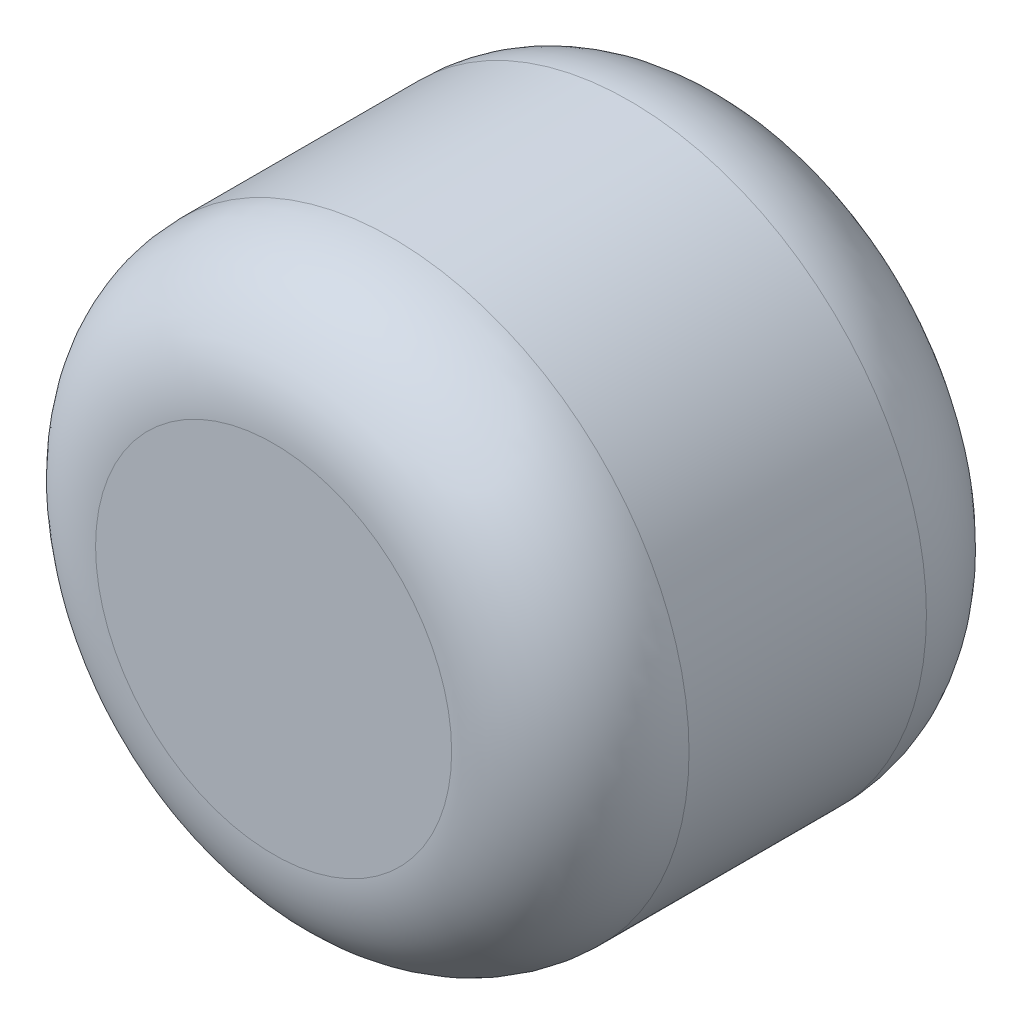
from build123d import *

# Parameters (mm, degrees)
ESQUISSE1_R        = 63.5
BOSS_EXTRU_1_DEPTH = 101.6
CONG_1_R           = 25.4


with BuildPart() as part:
    # Esquisse1 → Boss.-Extru.1 (new body)
    with BuildSketch(Plane.XY):
        Circle(ESQUISSE1_R)
    extrude(amount=BOSS_EXTRU_1_DEPTH)

    # Congé1
    cong_1_edges = [part.edges().sort_by_distance(p)[0] for p in [
        (-63.5, 0, 0),
        (-63.5, 0, 101.6),
    ]]
    fillet(cong_1_edges, radius=CONG_1_R)


solid = part.part
